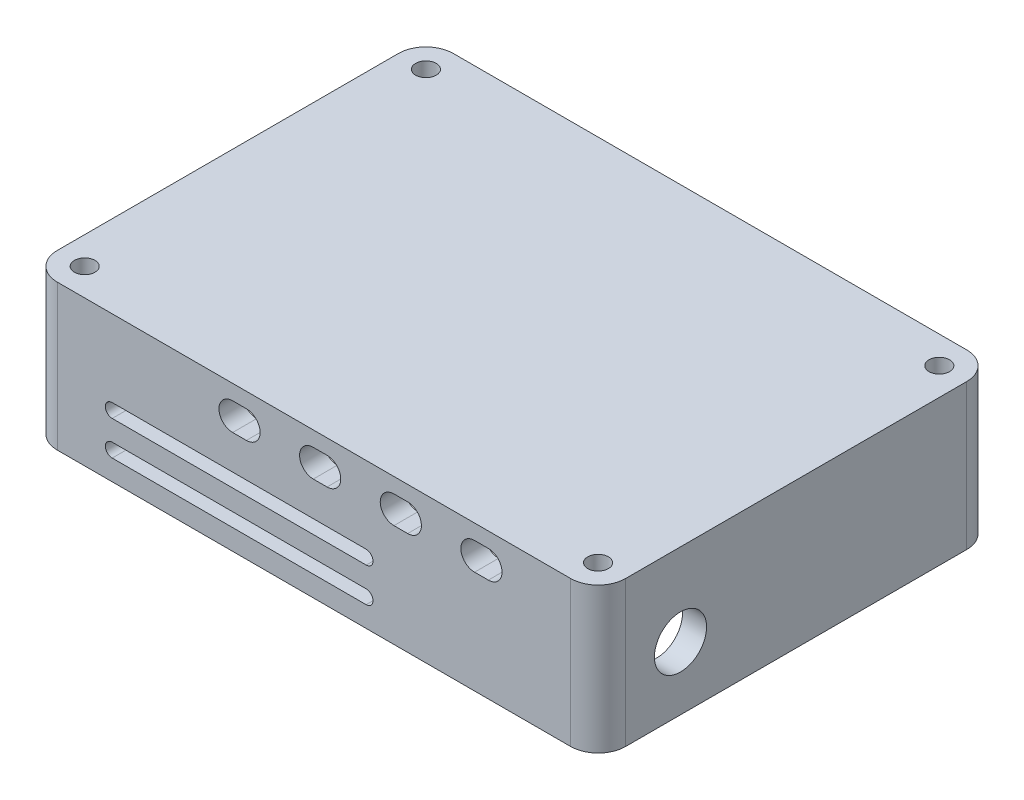
from build123d import *

# Parameters (mm, degrees)
SKETCH1_W           = 82.8
SKETCH1_H           = 57.7
BOSS_EXTRUDE1_DEPTH = 21.2
SKETCH2_R           = 1.5
CUT_EXTRUDE1_DEPTH  = 22
CUT_EXTRUDE2_DEPTH  = 20
FILLET3_R           = 4
BOSS_EXTRUDE3_START = 1
BOSS_EXTRUDE3_DEPTH = 1
CUT_EXTRUDE6_DEPTH  = 126.949440358
SKETCH8_R           = 3.8
CUT_EXTRUDE7_DEPTH  = 91.96532852
CUT_EXTRUDE8_DEPTH  = 10


with BuildPart() as part:
    # Sketch1 → Boss-Extrude1 (new body)
    with BuildSketch(Plane(origin=(0, 0, 0), x_dir=(1, 0, 0), z_dir=(0, 1, 0))):
        with Locations((-68.529666271, 2.285365627)):
            Rectangle(SKETCH1_W, SKETCH1_H)
    extrude(amount=BOSS_EXTRUDE1_DEPTH)

    # Sketch2 → Cut-Extrude1 (cut)
    with BuildSketch(Plane.XZ):
        with Locations((-105.929666271, 22.574078856)):
            Circle(SKETCH2_R)
        with Locations((-31.129666271, 22.574078856)):
            Circle(SKETCH2_R)
        with Locations((-105.929666271, -27.14481011)):
            Circle(SKETCH2_R)
        with Locations((-31.129666271, -27.14481011)):
            Circle(SKETCH2_R)
    extrude(amount=-CUT_EXTRUDE1_DEPTH, mode=Mode.SUBTRACT)

    # Sketch3 → Cut-Extrude2 (cut)
    with BuildSketch(Plane.XZ):
        with BuildLine():
            Line((-101.969305307, 23.064634373), (-35.090027235, 23.064634373))
            ThreePointArc((-35.090027235, 23.064634373), (-33.948648913, 19.745651731), (-30.629666271, 18.604273409))
            Line((-30.629666271, 18.604273409), (-30.629666271, -23.175004663))
            ThreePointArc((-30.629666271, -23.175004663), (-33.948648913, -24.316382985), (-35.090027235, -27.635365627))
            Line((-35.090027235, -27.635365627), (-101.969305307, -27.635365627))
            ThreePointArc((-101.969305307, -27.635365627), (-103.110683629, -24.316382985), (-106.429666271, -23.175004663))
            Line((-106.429666271, -23.175004663), (-106.429666271, 18.607164142))
            ThreePointArc((-106.429666271, 18.607164142), (-103.111962249, 19.747670443), (-101.969305307, 23.064634373))
        make_face()
    extrude(amount=-CUT_EXTRUDE2_DEPTH, mode=Mode.SUBTRACT)

    # Fillet3
    fillet3_edges = [part.edges().sort_by_distance(p)[0] for p in [
        (-27.129666271, 10.6, 26.564634373),
        (-109.929666271, 10.6, 26.564634373),
        (-109.929666271, 10.6, -31.135365627),
        (-27.129666271, 10.6, -31.135365627),
    ]]
    fillet(fillet3_edges, radius=FILLET3_R)

    # Sketch3<8> → Boss-Extrude3 (add)
    with BuildSketch(Plane.XZ.offset(BOSS_EXTRUDE3_START)):
        with BuildLine():
            Line((-103.334287863, 24.064634373), (-33.723727934, 24.064634373))
            ThreePointArc((-33.723727934, 24.064634373), (-33.241542132, 20.452758513), (-29.629666271, 19.97057271))
            Line((-29.629666271, 19.97057271), (-29.629666271, -24.541303964))
            ThreePointArc((-29.629666271, -24.541303964), (-33.241542132, -25.023489766), (-33.723727934, -28.635365627))
            Line((-33.723727934, -28.635365627), (-103.335604608, -28.635365627))
            ThreePointArc((-103.335604608, -28.635365627), (-103.817790411, -25.023489766), (-107.429666271, -24.541303964))
            Line((-107.429666271, -24.541303964), (-107.429666271, 19.973301106))
            ThreePointArc((-107.429666271, 19.973301106), (-103.819200468, 20.454646008), (-103.334287863, 24.064634373))
        make_face()
        with BuildLine():
            Line((-101.969305307, 23.064634373), (-35.090027235, 23.064634373))
            ThreePointArc((-35.090027235, 23.064634373), (-33.948648913, 19.745651731), (-30.629666271, 18.604273409))
            Line((-30.629666271, 18.604273409), (-30.629666271, -23.175004663))
            ThreePointArc((-30.629666271, -23.175004663), (-33.948648913, -24.316382985), (-35.090027235, -27.635365627))
            Line((-35.090027235, -27.635365627), (-101.969305307, -27.635365627))
            ThreePointArc((-101.969305307, -27.635365627), (-103.110683629, -24.316382985), (-106.429666271, -23.175004663))
            Line((-106.429666271, -23.175004663), (-106.429666271, 18.607164142))
            ThreePointArc((-106.429666271, 18.607164142), (-103.111962249, 19.747670443), (-101.969305307, 23.064634373))
        make_face(mode=Mode.SUBTRACT)
    extrude(amount=-BOSS_EXTRUDE3_DEPTH)

    # Sketch7 → Cut-Extrude6 (cut, through all)
    with BuildSketch(Plane(origin=(0, 0, -31.135365627), x_dir=(-1, 0, 0), z_dir=(0, 0, -1))):
        with BuildLine():
            Line((60.929666271, 3), (97.929666271, 3))
            ThreePointArc((97.929666271, 3), (98.929666271, 4), (97.929666271, 5))
            Line((97.929666271, 5), (60.929666271, 5))
            ThreePointArc((60.929666271, 5), (59.929666271, 4), (60.929666271, 3))
        make_face()
        with BuildLine():
            Line((60.929666271, 8), (97.929666271, 8))
            ThreePointArc((97.929666271, 8), (98.929666271, 9), (97.929666271, 10))
            Line((97.929666271, 10), (60.929666271, 10))
            ThreePointArc((60.929666271, 10), (59.929666271, 9), (60.929666271, 8))
        make_face()
    extrude(amount=-CUT_EXTRUDE6_DEPTH, mode=Mode.SUBTRACT)

    # Sketch8 → Cut-Extrude7 (cut, through all)
    with BuildSketch(Plane.ZY.offset(109.929666271)):
        with Locations((14.564634373, 9.2)):
            Circle(SKETCH8_R)
    extrude(amount=-CUT_EXTRUDE7_DEPTH, mode=Mode.SUBTRACT)

    # Sketch10 → Cut-Extrude8 (cut)
    with BuildSketch(Plane.XY.offset(26.564634373)):
        with BuildLine():
            Line((-43.129666271, 15), (-45.129666271, 15))
            ThreePointArc((-45.129666271, 15), (-47.129666271, 17), (-45.129666271, 19))
            Line((-45.129666271, 19), (-43.129666271, 19))
            ThreePointArc((-43.129666271, 19), (-41.129666271, 17), (-43.129666271, 15))
        make_face()
        with BuildLine():
            Line((-54.879666271, 15), (-56.879666271, 15))
            ThreePointArc((-56.879666271, 15), (-58.879666271, 17), (-56.879666271, 19))
            Line((-56.879666271, 19), (-54.879666271, 19))
            ThreePointArc((-54.879666271, 19), (-52.879666271, 17), (-54.879666271, 15))
        make_face()
        with BuildLine():
            Line((-66.629666271, 15), (-68.629666271, 15))
            ThreePointArc((-68.629666271, 15), (-70.629666271, 17), (-68.629666271, 19))
            Line((-68.629666271, 19), (-66.629666271, 19))
            ThreePointArc((-66.629666271, 19), (-64.629666271, 17), (-66.629666271, 15))
        make_face()
        with BuildLine():
            Line((-78.379666271, 15), (-80.379666271, 15))
            ThreePointArc((-80.379666271, 15), (-82.379666271, 17), (-80.379666271, 19))
            Line((-80.379666271, 19), (-78.379666271, 19))
            ThreePointArc((-78.379666271, 19), (-76.379666271, 17), (-78.379666271, 15))
        make_face()
    extrude(amount=-CUT_EXTRUDE8_DEPTH, mode=Mode.SUBTRACT)


solid = part.part
